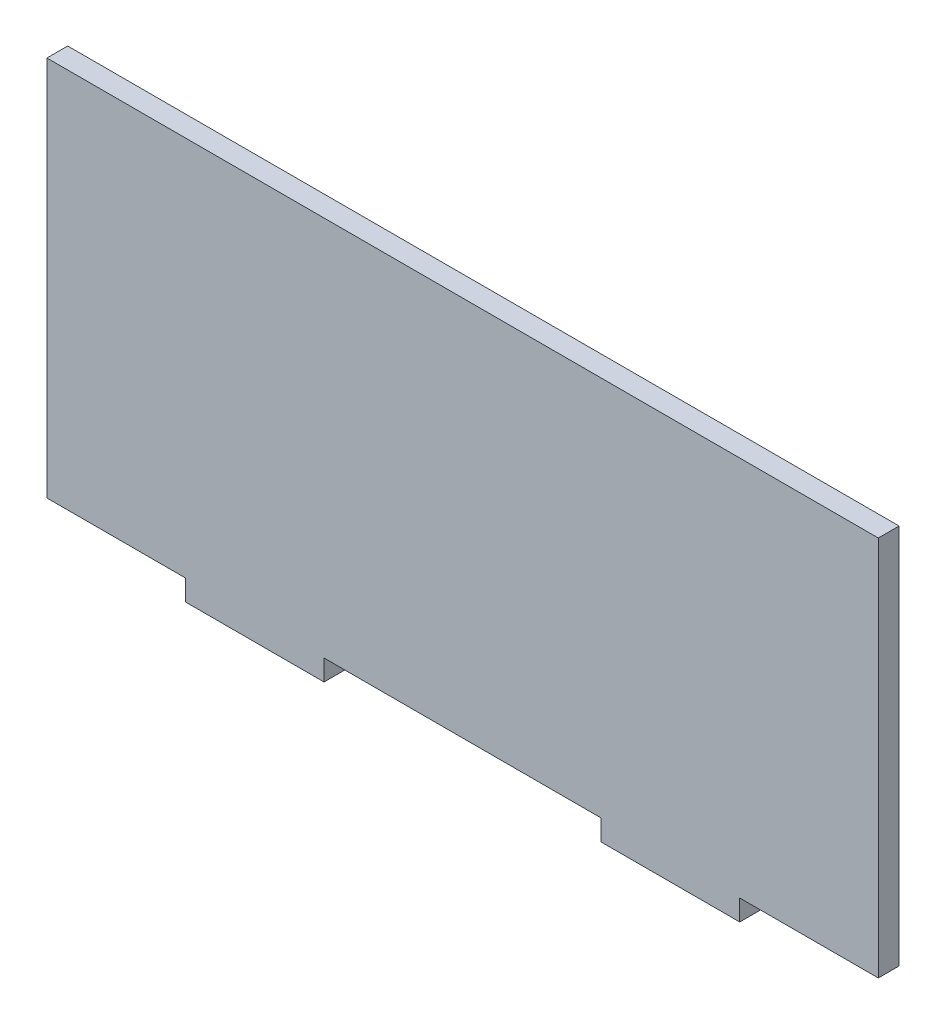
from build123d import *

# Parameters (mm, degrees)
SKETCH1_W           = 120
SKETCH1_H           = 55
BOSS_EXTRUDE1_DEPTH = 3
SKETCH2_W           = 20
SKETCH2_H           = 3
BOSS_EXTRUDE2_DEPTH = 3


with BuildPart() as part:
    # Sketch1 → Boss-Extrude1 (new body)
    with BuildSketch(Plane.XY):
        with Locations((60, 27.5)):
            Rectangle(SKETCH1_W, SKETCH1_H)
    extrude(amount=-BOSS_EXTRUDE1_DEPTH)

    # Sketch2 → Boss-Extrude2 (add)
    with BuildSketch(Plane.XY):
        with Locations((30, -1.5)):
            Rectangle(SKETCH2_W, SKETCH2_H)
        with Locations((90, -1.5)):
            Rectangle(SKETCH2_W, SKETCH2_H)
    extrude(amount=-BOSS_EXTRUDE2_DEPTH)


solid = part.part
